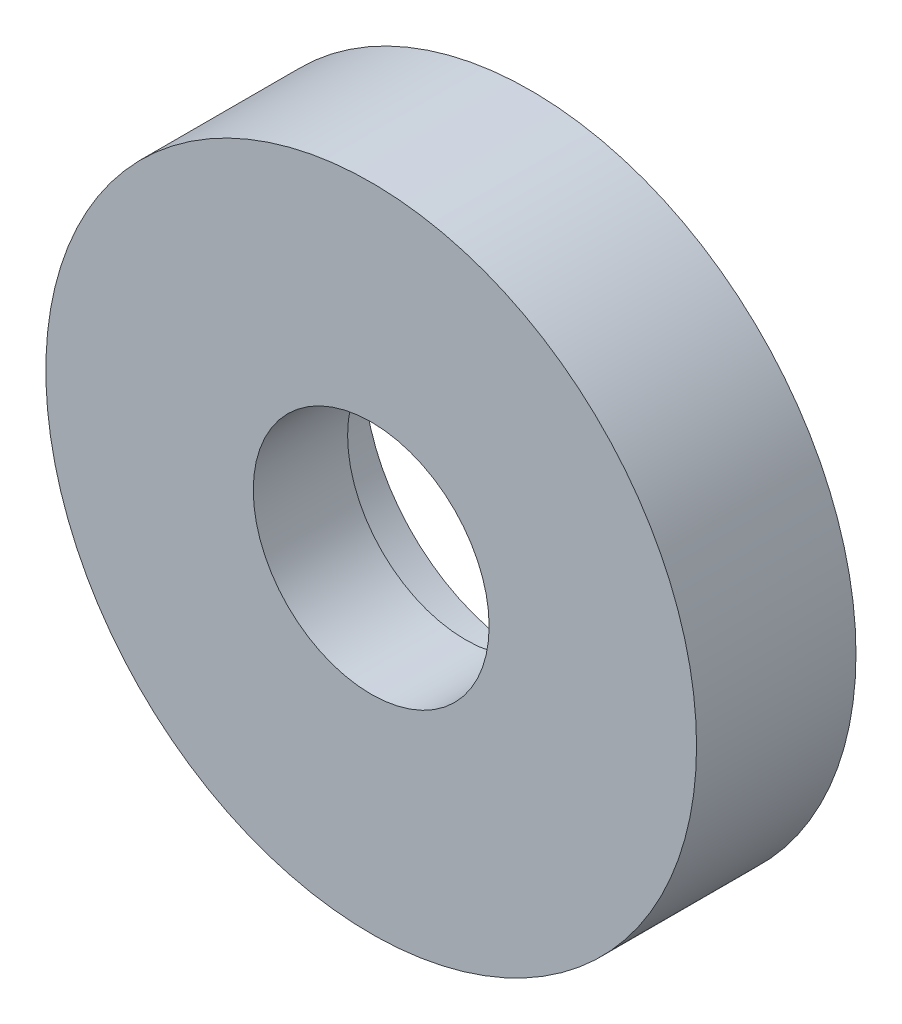
from build123d import *

# Parameters (mm, degrees)
SKIZZE1_R                       = 20
SKIZZE1_R_2                     = 7.25
AUFSATZ_LINEAR_AUSTRAGEN1_DEPTH = 9.8
SKIZZE2_R                       = 10.25
SCHNITT_LINEAR_AUSTRAGEN1_DEPTH = 4


with BuildPart() as part:
    # Skizze1 → Aufsatz-Linear austragen1 (new body)
    with BuildSketch(Plane.XY):
        Circle(SKIZZE1_R)
        Circle(SKIZZE1_R_2, mode=Mode.SUBTRACT)
    extrude(amount=AUFSATZ_LINEAR_AUSTRAGEN1_DEPTH)

    # Skizze2 → Schnitt-Linear austragen1 (cut)
    with BuildSketch(Plane(origin=(0, 0, 0), x_dir=(-1, 0, 0), z_dir=(0, 0, -1))):
        Circle(SKIZZE2_R)
    extrude(amount=-SCHNITT_LINEAR_AUSTRAGEN1_DEPTH, mode=Mode.SUBTRACT)


solid = part.part
